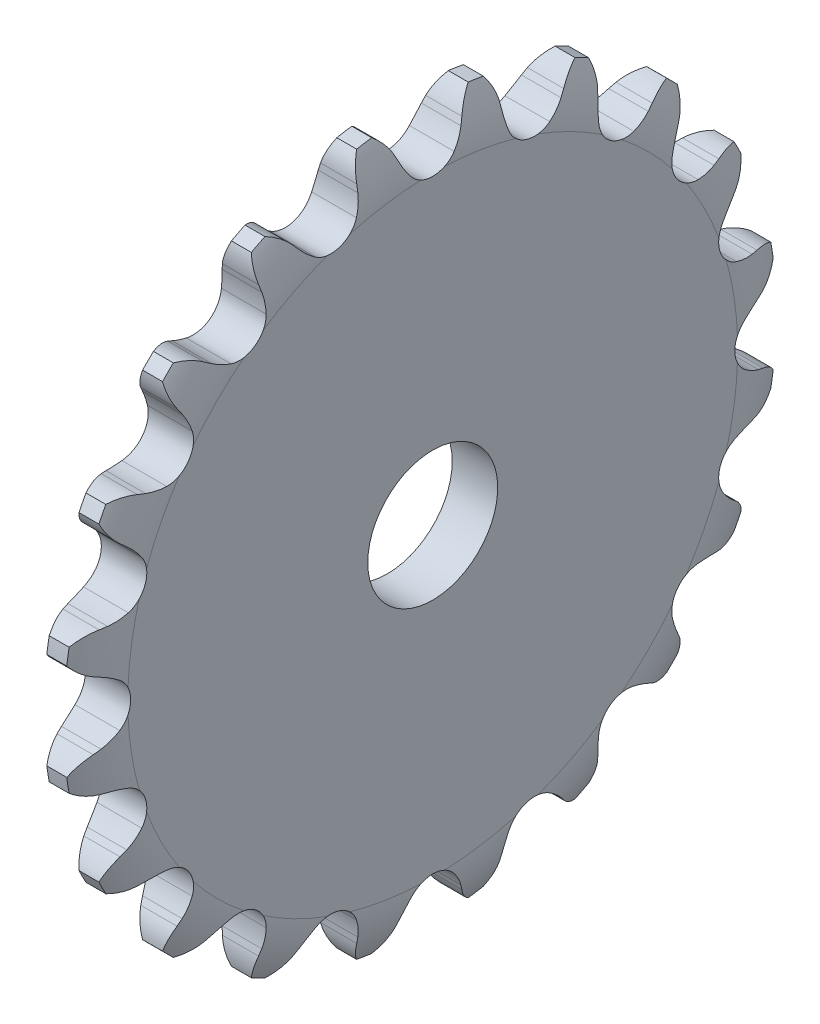
from build123d import *

# Parameters (mm, degrees)
TOOTHCUT_DEPTH  = 32.169679271
TEETHCUTS_COUNT = 20
TEETHCUTS_ANGLE = 342
BORSKE_R        = 4
BORE_DEPTH      = 50.8000508


with BuildPart() as part:
    # BasProSke → Base-Revolve (revolve)
    with BuildSketch(Plane(origin=(0, 0, 0), x_dir=(1, 0, 0), z_dir=(0, 1, 0)), mode=Mode.PRIVATE) as base_revolve_sk:
        with BuildLine():
            Line((0, 0), (0, 18.776161082))
            ThreePointArc((0, 18.776161082), (0.199787117, 20.411751477), (0.7874, 21.951161082))
            Line((0.7874, 21.951161082), (2.01295, 21.951161082))
            ThreePointArc((2.01295, 21.951161082), (2.600562883, 20.411751477), (2.80035, 18.776161082))
            Line((2.80035, 18.776161082), (2.80035, 0))
            Line((2.80035, 0), (0, 0))
        make_face()
    revolve(base_revolve_sk.sketch.rotate(Axis((-10, 0, 0), (1, 0, 0)), 180), axis=Axis((-10, 0, 0), (1, 0, 0)))

    # TooCutSke → ToothCut (cut, through all)
    with BuildSketch(Plane(origin=(0, 0, 0), x_dir=(0, 0, -1), z_dir=(1, 0, 0))):
        with BuildLine():
            Line((1.918313524, 20.240957663), (2.077231161, 20.619007781))
            ThreePointArc((2.077231161, 20.619007781), (3.071954195, 21.821421376), (4.565885661, 22.272465878))
            ThreePointArc((4.565885661, 22.272465878), (0, 22.735655877), (-4.565885661, 22.272465878))
            ThreePointArc((-4.565885661, 22.272465878), (-3.071954195, 21.821421376), (-2.077231161, 20.619007781))
            Line((-2.077231161, 20.619007781), (-1.918313524, 20.240957663))
            ThreePointArc((-1.918313524, 20.240957663), (-1.660798791, 19.726712623), (-1.337533993, 19.251042918))
            ThreePointArc((-1.337533993, 19.251042918), (0, 18.598684001), (1.337533993, 19.251042918))
            ThreePointArc((1.337533993, 19.251042918), (1.660798791, 19.726712623), (1.918313524, 20.240957663))
        make_face()
    toothcut = extrude(amount=TOOTHCUT_DEPTH, mode=Mode.SUBTRACT)

    # TeethCuts: ToothCut ×20 about axis
    teethcuts_axis = Axis((-10, 0, 0), (1, 0, 0))
    for i in range(1, TEETHCUTS_COUNT):
        add(toothcut.rotate(teethcuts_axis, i * TEETHCUTS_ANGLE / (TEETHCUTS_COUNT - 1)), mode=Mode.SUBTRACT)

    # BorSke → Bore (cut, symmetric)
    with BuildSketch(Plane(origin=(0, 0, 0), x_dir=(0, 0, -1), z_dir=(1, 0, 0))):
        with Locations(Location((0, 0, 0), (0, 0, 180))):
            Circle(BORSKE_R)
    extrude(amount=BORE_DEPTH, both=True, mode=Mode.SUBTRACT)


solid = part.part
